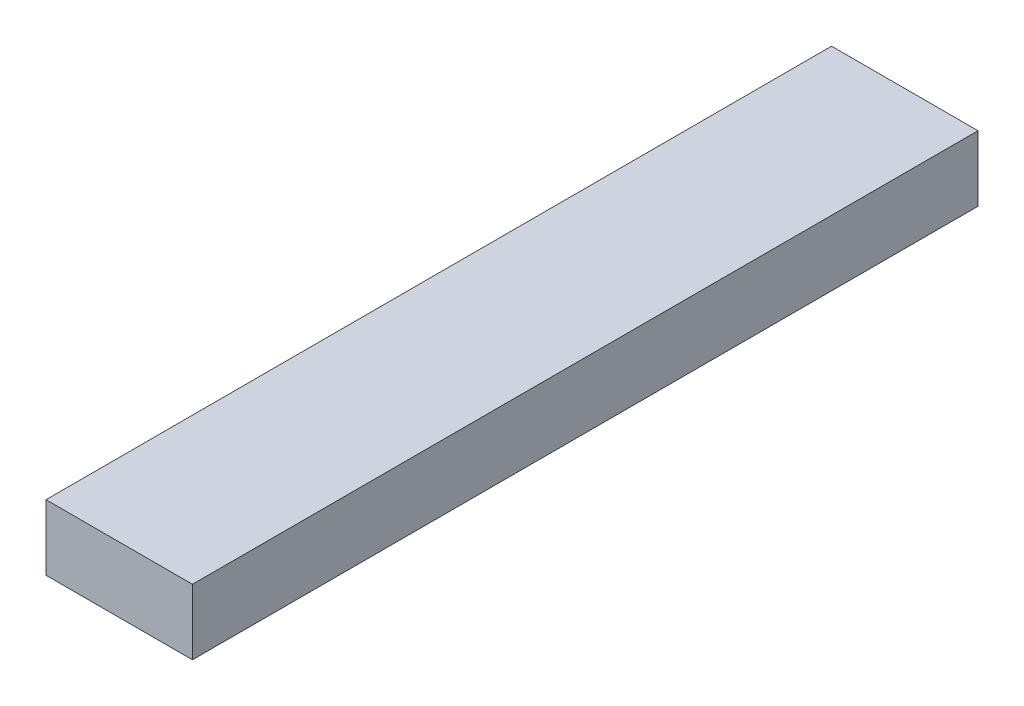
from build123d import *

# Parameters (mm, degrees)
SKETCH1_W           = 16.6624
SKETCH1_H           = 37.2872
BOSS_EXTRUDE1_DEPTH = 100


with BuildPart() as part:
    # Sketch1 → Boss-Extrude1 (new, symmetric)
    with BuildSketch(Plane(origin=(0, 0, 0), x_dir=(0, 1, 0), z_dir=(0, 0, 1))):
        Rectangle(SKETCH1_W, SKETCH1_H)
    extrude(amount=BOSS_EXTRUDE1_DEPTH, both=True)


solid = part.part
